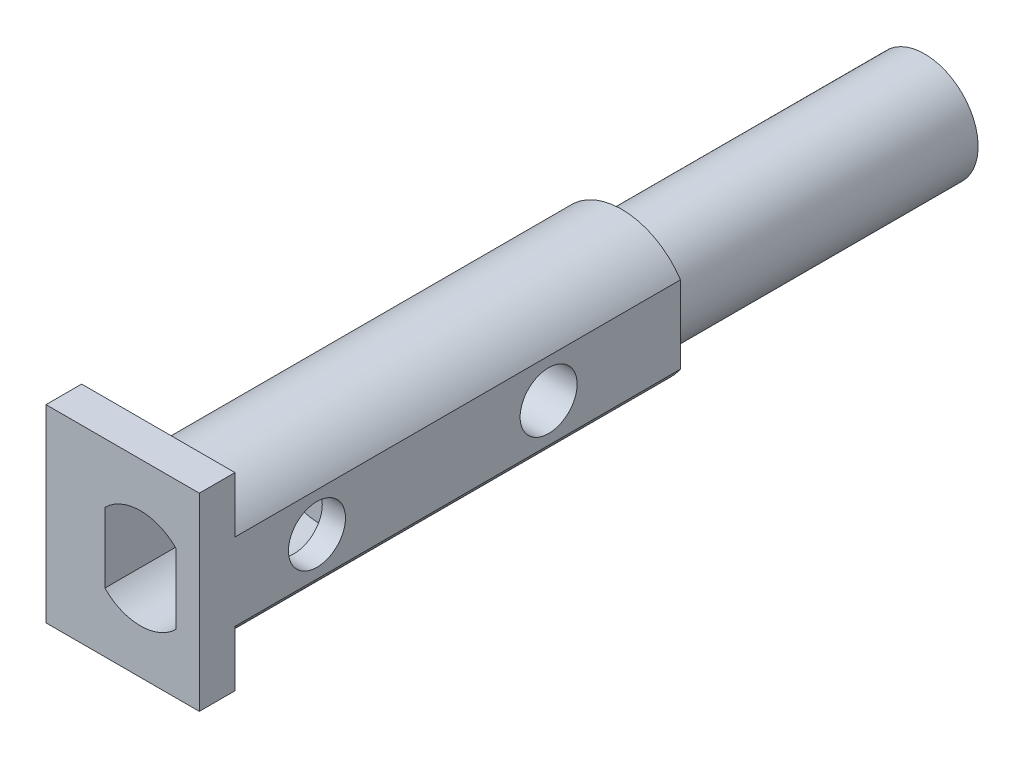
from build123d import *

# Parameters (mm, degrees)
IZIM1_W                     = 10.606601718
IZIM1_H                     = 10.606601718
Y_KSEKLIK_EKSTR_ZYON1_DEPTH = 2
IZIM2_R                     = 3.95
Y_KSEKLIK_EKSTR_ZYON2_DEPTH = 25
KES_EKSTR_ZYON1_DEPTH       = 10
IZIM5_R                     = 1.6
KES_EKSTR_ZYON3_DEPTH       = 26
IZIM8_W                     = 5
IZIM8_H                     = 13.621024602
KES_EKSTR_ZYON4_DEPTH       = 29.022312538
SKETCH2_R                   = 3
BOSS_EXTRUDE1_DEPTH         = 17


with BuildPart() as part:
    # Çizim1 → Yükseklik-Ekstrüzyon1 (new body)
    with BuildSketch(Plane.XY):
        Rectangle(IZIM1_W, IZIM1_H)
    extrude(amount=Y_KSEKLIK_EKSTR_ZYON1_DEPTH)

    # Çizim2 → Yükseklik-Ekstrüzyon2 (add)
    with BuildSketch(Plane(origin=(0, 0, 0), x_dir=(-1, 0, 0), z_dir=(0, 0, -1))):
        with Locations(Location((0, 0, 0), (0, 0, 180))):
            Circle(IZIM2_R)
    extrude(amount=Y_KSEKLIK_EKSTR_ZYON2_DEPTH)

    # Çizim3 → Kes-Ekstrüzyon1 (cut)
    with BuildSketch(Plane.XY.offset(2)):
        with BuildLine():
            Line((-2, -1.959591794), (-2, 1.959591794))
            ThreePointArc((-2, 1.959591794), (0, 2.8), (2, 1.959591794))
            Line((2, 1.959591794), (2, -1.959591794))
            ThreePointArc((2, -1.959591794), (0, -2.8), (-2, -1.959591794))
        make_face()
    extrude(amount=-KES_EKSTR_ZYON1_DEPTH, mode=Mode.SUBTRACT)

    # Çizim5 → Kes-Ekstrüzyon3 (cut, symmetric)
    with BuildSketch(Plane(origin=(0, 0, 0), x_dir=(0, 0, -1), z_dir=(1, 0, 0))):
        with Locations((4.6, 0)):
            Circle(IZIM5_R)
        with Locations((17.6, 0)):
            Circle(IZIM5_R)
    extrude(amount=KES_EKSTR_ZYON3_DEPTH, both=True, mode=Mode.SUBTRACT)

    # Çizim8 → Kes-Ekstrüzyon4 (cut, through all)
    with BuildSketch(Plane(origin=(0, 0, -25), x_dir=(-1, 0, 0), z_dir=(0, 0, -1))):
        with Locations((-5.8, 0)):
            Rectangle(IZIM8_W, IZIM8_H)
    extrude(amount=-KES_EKSTR_ZYON4_DEPTH, mode=Mode.SUBTRACT)

    # Sketch2 → Boss-Extrude1 (add)
    with BuildSketch(Plane(origin=(0, 0, -25), x_dir=(-1, 0, 0), z_dir=(0, 0, -1))):
        Circle(SKETCH2_R)
    extrude(amount=BOSS_EXTRUDE1_DEPTH)


solid = part.part
